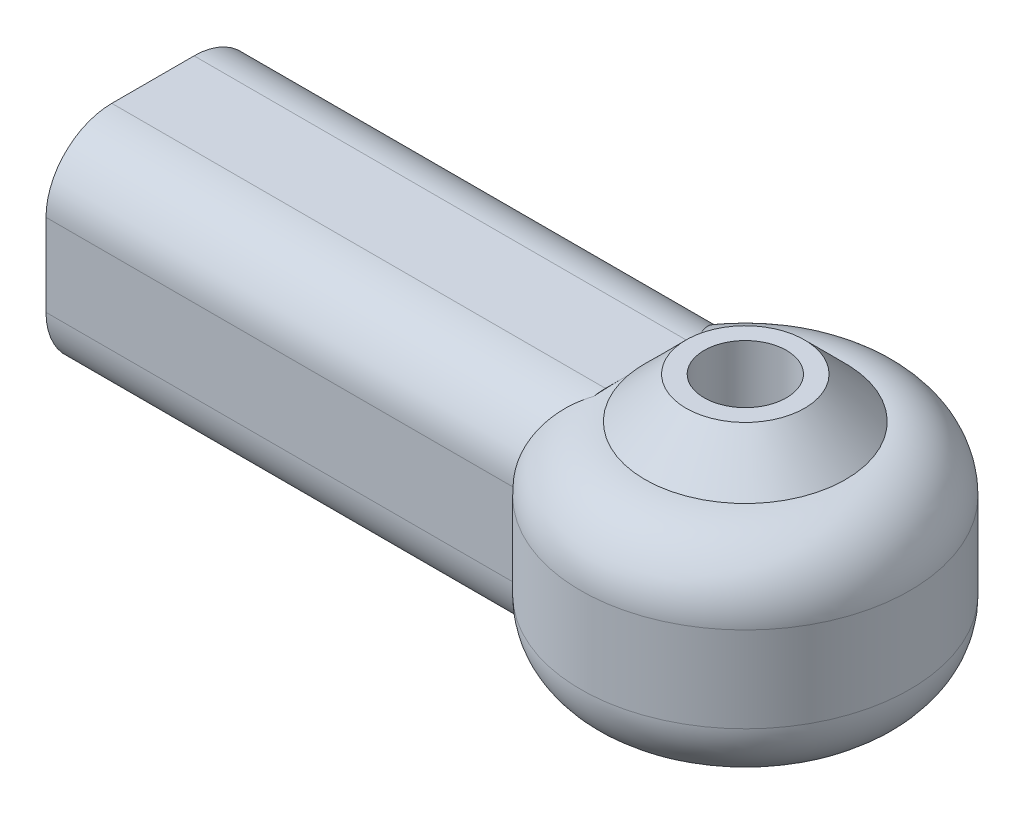
from build123d import *

# Parameters (mm, degrees)
BOSS_EXTRUDE1_DEPTH     = 30
SKETCH1_3_R             = 5
CUT_EXTRUDE1_DEPTH      = 25
CHAMFER1_SIZE           = 0.75
SKETCH3_W               = 10
SKETCH3_H               = 5
SKETCH7_R               = 6.1
BOSS_EXTRUDE3_DEPTH     = 2.5
BOSS_EXTRUDE3_TAPER     = 45
CUT_EXTRUDE3_DEPTH      = 51.39841282
CUT_EXTRUDE3_DEPTH_BACK = 200
SKETCH8_R               = 2.5


with BuildPart() as part:
    # Sketch1 → Boss-Extrude1 (new body)
    with BuildSketch(Plane(origin=(0, 0, 0), x_dir=(0, 0, -1), z_dir=(1, 0, 0))):
        with BuildLine():
            ThreePointArc((6.5, 2.5), (5.328427125, 5.328427125), (2.5, 6.5))
            Line((2.5, 6.5), (-2.5, 6.5))
            ThreePointArc((-2.5, 6.5), (-5.328427125, 5.328427125), (-6.5, 2.5))
            Line((-6.5, 2.5), (-6.5, -2.5))
            ThreePointArc((-6.5, -2.5), (-5.328427125, -5.328427125), (-2.5, -6.5))
            Line((-2.5, -6.5), (2.5, -6.5))
            ThreePointArc((2.5, -6.5), (5.328427125, -5.328427125), (6.5, -2.5))
            Line((6.5, -2.5), (6.5, 2.5))
        make_face()
    extrude(amount=BOSS_EXTRUDE1_DEPTH)

    # Sketch1<3> → Cut-Extrude1 (cut)
    with BuildSketch(Plane(origin=(0, 0, 0), x_dir=(0, 0, -1), z_dir=(1, 0, 0))):
        Circle(SKETCH1_3_R)
    extrude(amount=CUT_EXTRUDE1_DEPTH, mode=Mode.SUBTRACT)

    # Chamfer1
    chamfer1_edges = [part.edges().sort_by_distance(p)[0] for p in [
        (0, 0, 5),
    ]]
    chamfer(chamfer1_edges, length=CHAMFER1_SIZE)

    # Sketch3 → Revolve2 (revolve)
    with BuildSketch(Plane(origin=(36, 0, 0), x_dir=(0, 0, -1), z_dir=(1, 0, 0))):
        with Locations((-5, 0)):
            Rectangle(SKETCH3_W, SKETCH3_H)
    revolve(axis=Axis((36, -11.950836094, 0), (0, 1, 0)))

    # Sketch4 → Revolve3 (revolve)
    with BuildSketch(Plane(origin=(36, 0, 0), x_dir=(0, 0, -1), z_dir=(1, 0, 0))):
        with BuildLine():
            Line((0, 2.5), (-10, 2.5))
            Line((-10, 2.5), (-10, 2.6))
            ThreePointArc((-10, 2.6), (-8.857716447, 5.357716447), (-6.1, 6.5))
            Line((-6.1, 6.5), (0, 6.5))
            Line((0, 6.5), (0, 2.5))
        make_face()
    revolve3 = revolve(axis=Axis((36, -7.102905922, 0), (0, 1, 0)))

    # Mirror3: Revolve3 across plane
    add(revolve3.mirror(Plane.ZX))

    # Sketch7 → Boss-Extrude3 (add)
    with BuildSketch(Plane(origin=(0, 6.5, 0), x_dir=(1, 0, 0), z_dir=(0, 1, 0))):
        with Locations((36, 0)):
            Circle(SKETCH7_R)
    boss_extrude3 = extrude(amount=BOSS_EXTRUDE3_DEPTH, taper=BOSS_EXTRUDE3_TAPER)

    # Mirror5: Boss-Extrude3 across plane
    add(boss_extrude3.mirror(Plane.ZX))

    # Sketch8 → Cut-Extrude3 (cut, two sides: drawn at the far end of the back side and taken through both)
    with BuildSketch(Plane(origin=(0, 9, 0), x_dir=(1, 0, 0), z_dir=(0, 1, 0)).offset(-CUT_EXTRUDE3_DEPTH_BACK)):
        with Locations((36, 0)):
            Circle(SKETCH8_R)
    extrude(amount=CUT_EXTRUDE3_DEPTH + CUT_EXTRUDE3_DEPTH_BACK, mode=Mode.SUBTRACT)


solid = part.part
